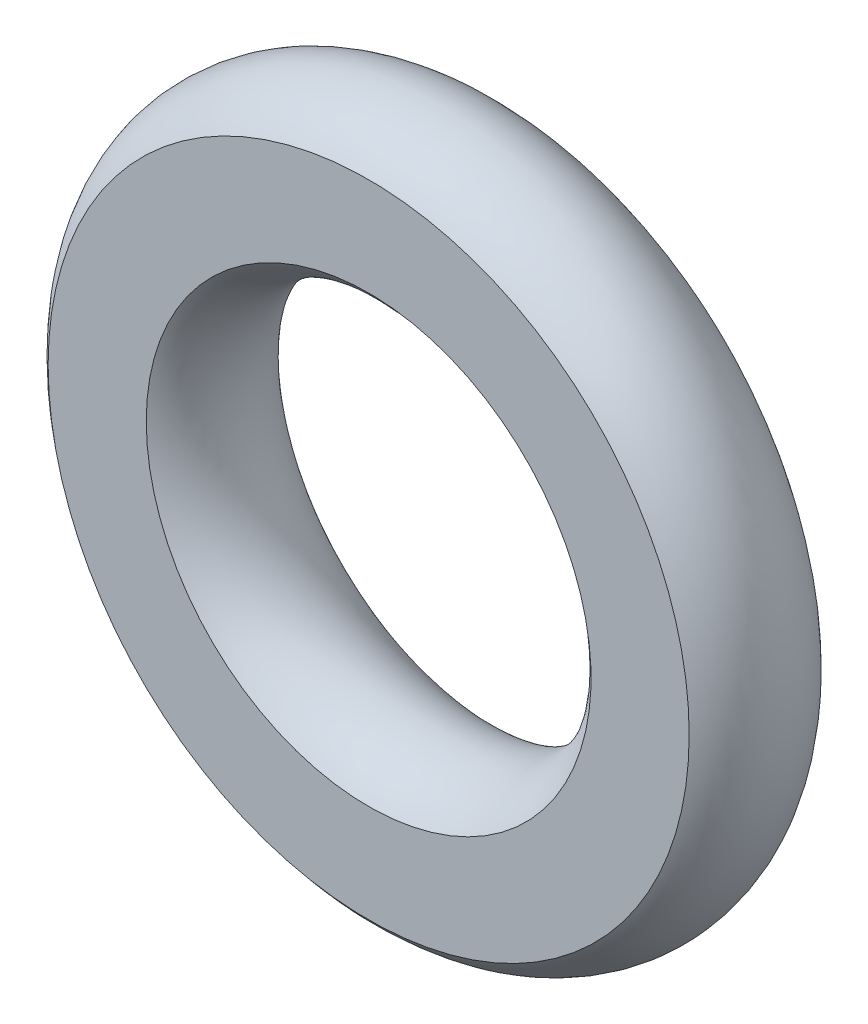
from build123d import *

# Parameters (mm, degrees)
SKETCH2_R          = 0.635
SKETCH4_R          = 3.175
CUT_EXTRUDE3_DEPTH = 0.127


with BuildPart() as part:
    # Sketch2 → Revolve1 (revolve)
    with BuildSketch(Plane(origin=(0, 0, 0), x_dir=(1, 0, 0), z_dir=(0, 1, 0)), mode=Mode.PRIVATE) as revolve1_sk:
        with Locations((2.1082, 0)):
            Circle(SKETCH2_R)
    revolve(revolve1_sk.sketch.rotate(Axis((0, 0, 0), (0, 0, 1)), 180), axis=Axis((0, 0, 0), (0, 0, 1)))

    # Sketch4 → Cut-Extrude3 (cut, symmetric)
    with BuildSketch(Plane.XY.offset(0.635)):
        Circle(SKETCH4_R)
    extrude(amount=CUT_EXTRUDE3_DEPTH, both=True, mode=Mode.SUBTRACT)


solid = part.part
